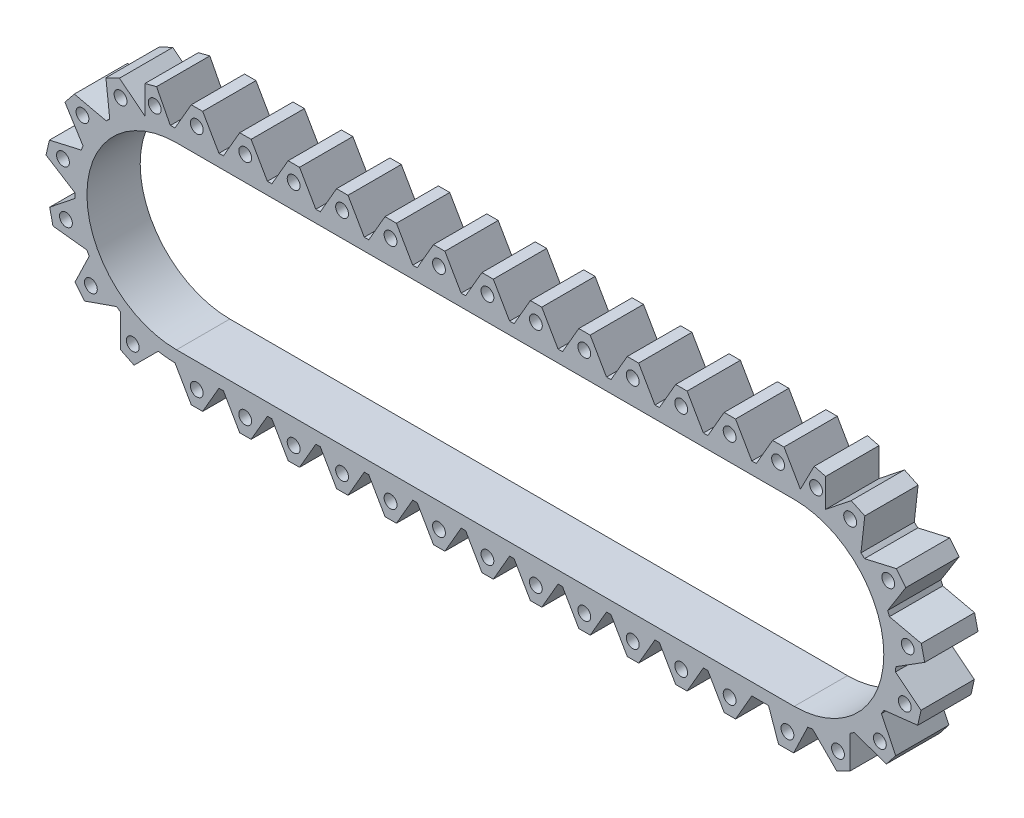
from build123d import *

# Parameters (mm, degrees)
SKETCH1_R           = 5.304855617
BOSS_EXTRUDE1_DEPTH = 44


with BuildPart() as part:
    # Sketch1 → Boss-Extrude1 (new body)
    with BuildSketch(Plane.XY):
        with BuildLine():
            Line((-368.279008081, 208.137347398), (-377.693162141, 208.137347398))
            Line((-377.693162141, 208.137347398), (-391.140624551, 184.84565927))
            ThreePointArc((-391.140624551, 184.84565927), (-393.055558066, 184.794572872), (-394.968828688, 184.699832656))
            Line((-394.968828688, 184.699832656), (-406.364309987, 206.757674175))
            Line((-406.364309987, 206.757674175), (-415.856306602, 204.306802161))
            Line((-415.856306602, 204.306802161), (-415.856306602, 180.730933767))
            Line((-415.856306602, 180.730933767), (-436.937315979, 197.542477756))
            Line((-436.937315979, 197.542477756), (-448.168387597, 192.210115525))
            Line((-448.168387597, 192.210115525), (-445.013595724, 164.210563225))
            ThreePointArc((-445.013595724, 164.210563225), (-446.491708161, 162.892805497), (-447.938347028, 161.540571127))
            Line((-447.938347028, 161.540571127), (-474.225935747, 167.540541709))
            Line((-474.225935747, 167.540541709), (-482.031156365, 157.863269999))
            Line((-482.031156365, 157.863269999), (-467.040236656, 134.005357956))
            ThreePointArc((-467.040236656, 134.005357956), (-467.800216295, 132.176770316), (-468.516880373, 130.330776165))
            Line((-468.516880373, 130.330776165), (-494.804469092, 124.330805583))
            Line((-494.804469092, 124.330805583), (-497.637919041, 112.225326739))
            Line((-497.637919041, 112.225326739), (-473.780006998, 97.234407031))
            ThreePointArc((-473.780006998, 97.234407031), (-473.671330551, 95.257163688), (-473.516075729, 93.283031538))
            Line((-473.516075729, 93.283031538), (-494.597085106, 76.471487549))
            Line((-494.597085106, 76.471487549), (-491.897564874, 64.335440122))
            Line((-491.897564874, 64.335440122), (-463.898012575, 61.180648248))
            ThreePointArc((-463.898012575, 61.180648248), (-462.942204744, 59.446366495), (-461.945781144, 57.73509743))
            Line((-461.945781144, 57.73509743), (-473.644858731, 33.441712501))
            Line((-473.644858731, 33.441712501), (-465.947041408, 23.678789521))
            Line((-465.947041408, 23.678789521), (-439.351503576, 32.984970704))
            ThreePointArc((-439.351503576, 32.984970704), (-437.737873826, 31.837146312), (-436.097635362, 30.727678157))
            Line((-436.097635362, 30.727678157), (-436.097635362, 3.764055113))
            Line((-436.097635362, 3.764055113), (-424.926168076, -1.692076789))
            Line((-424.926168076, -1.692076789), (-405.002217154, 18.231874134))
            ThreePointArc((-405.002217154, 18.231874134), (-398.099796392, 17.260748368), (-391.140624551, 16.865242473))
            Line((-391.140624551, 16.865242473), (-377.693162141, -6.426445656))
            Line((-377.693162141, -6.426445656), (-368.279008081, -6.426445656))
            Line((-368.279008081, -6.426445656), (-354.837198854, 16.855450871))
            Line((-354.837198854, 16.855450871), (-351.134971368, 16.855450871))
            Line((-351.134971368, 16.855450871), (-337.693162141, -6.426445656))
            Line((-337.693162141, -6.426445656), (-328.279008081, -6.426445656))
            Line((-328.279008081, -6.426445656), (-314.837198854, 16.855450871))
            Line((-314.837198854, 16.855450871), (-311.134971368, 16.855450871))
            Line((-311.134971368, 16.855450871), (-297.693162141, -6.426445656))
            Line((-297.693162141, -6.426445656), (-288.279008081, -6.426445656))
            Line((-288.279008081, -6.426445656), (-274.837198854, 16.855450871))
            Line((-274.837198854, 16.855450871), (-271.134971368, 16.855450871))
            Line((-271.134971368, 16.855450871), (-257.693162141, -6.426445656))
            Line((-257.693162141, -6.426445656), (-248.279008081, -6.426445656))
            Line((-248.279008081, -6.426445656), (-234.837198854, 16.855450871))
            Line((-234.837198854, 16.855450871), (-231.134971368, 16.855450871))
            Line((-231.134971368, 16.855450871), (-217.693162141, -6.426445656))
            Line((-217.693162141, -6.426445656), (-208.279008081, -6.426445656))
            Line((-208.279008081, -6.426445656), (-194.837198854, 16.855450871))
            Line((-194.837198854, 16.855450871), (-191.134971368, 16.855450871))
            Line((-191.134971368, 16.855450871), (-177.693162141, -6.426445656))
            Line((-177.693162141, -6.426445656), (-168.279008081, -6.426445656))
            Line((-168.279008081, -6.426445656), (-154.837198854, 16.855450871))
            Line((-154.837198854, 16.855450871), (-151.134971368, 16.855450871))
            Line((-151.134971368, 16.855450871), (-137.693162141, -6.426445656))
            Line((-137.693162141, -6.426445656), (-128.279008081, -6.426445656))
            Line((-128.279008081, -6.426445656), (-114.837198854, 16.855450871))
            Line((-114.837198854, 16.855450871), (-111.134971368, 16.855450871))
            Line((-111.134971368, 16.855450871), (-97.693162141, -6.426445656))
            Line((-97.693162141, -6.426445656), (-88.279008081, -6.426445656))
            Line((-88.279008081, -6.426445656), (-74.837198854, 16.855450871))
            Line((-74.837198854, 16.855450871), (-71.134971368, 16.855450871))
            Line((-71.134971368, 16.855450871), (-57.693162141, -6.426445656))
            Line((-57.693162141, -6.426445656), (-48.279008081, -6.426445656))
            Line((-48.279008081, -6.426445656), (-34.837198854, 16.855450871))
            Line((-34.837198854, 16.855450871), (-31.134971368, 16.855450871))
            Line((-31.134971368, 16.855450871), (-17.693162141, -6.426445656))
            Line((-17.693162141, -6.426445656), (-8.279008081, -6.426445656))
            Line((-8.279008081, -6.426445656), (5.162801146, 16.855450871))
            Line((5.162801146, 16.855450871), (8.865028632, 16.855450871))
            Line((8.865028632, 16.855450871), (22.306837859, -6.426445656))
            Line((22.306837859, -6.426445656), (31.720991919, -6.426445656))
            Line((31.720991919, -6.426445656), (45.162801146, 16.855450871))
            Line((45.162801146, 16.855450871), (48.865028632, 16.855450871))
            Line((48.865028632, 16.855450871), (62.306837859, -6.426445656))
            Line((62.306837859, -6.426445656), (71.720991919, -6.426445656))
            Line((71.720991919, -6.426445656), (85.162801146, 16.855450871))
            Line((85.162801146, 16.855450871), (88.865028632, 16.855450871))
            Line((88.865028632, 16.855450871), (88.971712538, 16.855450871))
            Line((88.971712538, 16.855450871), (98.982794632, 16.855450871))
            Line((98.982794632, 16.855450871), (107.129482574, -6.426445656))
            Line((107.129482574, -6.426445656), (107.243450607, -6.752147583))
            Line((107.243450607, -6.752147583), (119.675921751, -6.683460598))
            Line((119.675921751, -6.683460598), (131.374999338, 17.60992433))
            ThreePointArc((131.374999338, 17.60992433), (133.334183321, 17.897847801), (135.28603583, 18.231874134))
            Line((135.28603583, 18.231874134), (155.209986752, -1.692076789))
            Line((155.209986752, -1.692076789), (166.381454038, 3.764055113))
            Line((166.381454038, 3.764055113), (166.381454038, 30.727678157))
            ThreePointArc((166.381454038, 30.727678157), (168.021692502, 31.837146312), (169.635322252, 32.984970704))
            Line((169.635322252, 32.984970704), (196.230860084, 23.678789521))
            Line((196.230860084, 23.678789521), (203.928677407, 33.441712501))
            Line((203.928677407, 33.441712501), (192.22959982, 57.73509743))
            ThreePointArc((192.22959982, 57.73509743), (193.22602342, 59.446366495), (194.181831251, 61.180648248))
            Line((194.181831251, 61.180648248), (222.18138355, 64.335440122))
            Line((222.18138355, 64.335440122), (224.880903782, 76.471487549))
            Line((224.880903782, 76.471487549), (203.799894405, 93.283031538))
            ThreePointArc((203.799894405, 93.283031538), (203.955149227, 95.257163688), (204.063825674, 97.234407031))
            Line((204.063825674, 97.234407031), (227.921737717, 112.225326739))
            Line((227.921737717, 112.225326739), (225.088287768, 124.330805583))
            Line((225.088287768, 124.330805583), (198.800699049, 130.330776165))
            ThreePointArc((198.800699049, 130.330776165), (198.084034971, 132.176770316), (197.324055332, 134.005357956))
            Line((197.324055332, 134.005357956), (212.314975041, 157.863269999))
            Line((212.314975041, 157.863269999), (204.509754423, 167.540541709))
            Line((204.509754423, 167.540541709), (178.222165704, 161.540571127))
            ThreePointArc((178.222165704, 161.540571127), (176.775526837, 162.892805497), (175.2974144, 164.210563225))
            Line((175.2974144, 164.210563225), (178.452206273, 192.210115525))
            Line((178.452206273, 192.210115525), (167.221134655, 197.542477756))
            Line((167.221134655, 197.542477756), (146.140125278, 180.730933767))
            Line((146.140125278, 180.730933767), (146.140125278, 204.306802161))
            Line((146.140125278, 204.306802161), (136.648128663, 206.757674175))
            Line((136.648128663, 206.757674175), (125.252647364, 184.699832656))
            Line((125.252647364, 184.699832656), (111.720991919, 208.137347398))
            Line((111.720991919, 208.137347398), (102.306837859, 208.137347398))
            Line((102.306837859, 208.137347398), (88.865028632, 184.855450871))
            Line((88.865028632, 184.855450871), (85.162801146, 184.855450871))
            Line((85.162801146, 184.855450871), (76.790181677, 199.357253183))
            Line((76.790181677, 199.357253183), (71.720991919, 208.137347398))
            Line((71.720991919, 208.137347398), (62.306837859, 208.137347398))
            Line((62.306837859, 208.137347398), (48.865028632, 184.855450871))
            Line((48.865028632, 184.855450871), (45.162801146, 184.855450871))
            Line((45.162801146, 184.855450871), (31.720991919, 208.137347398))
            Line((31.720991919, 208.137347398), (22.306837859, 208.137347398))
            Line((22.306837859, 208.137347398), (8.865028632, 184.855450871))
            Line((8.865028632, 184.855450871), (5.162801146, 184.855450871))
            Line((5.162801146, 184.855450871), (-8.279008081, 208.137347398))
            Line((-8.279008081, 208.137347398), (-17.693162141, 208.137347398))
            Line((-17.693162141, 208.137347398), (-31.134971368, 184.855450871))
            Line((-31.134971368, 184.855450871), (-34.837198854, 184.855450871))
            Line((-34.837198854, 184.855450871), (-48.279008081, 208.137347398))
            Line((-48.279008081, 208.137347398), (-57.693162141, 208.137347398))
            Line((-57.693162141, 208.137347398), (-71.134971368, 184.855450871))
            Line((-71.134971368, 184.855450871), (-74.837198854, 184.855450871))
            Line((-74.837198854, 184.855450871), (-88.279008081, 208.137347398))
            Line((-88.279008081, 208.137347398), (-97.693162141, 208.137347398))
            Line((-97.693162141, 208.137347398), (-111.134971368, 184.855450871))
            Line((-111.134971368, 184.855450871), (-114.837198854, 184.855450871))
            Line((-114.837198854, 184.855450871), (-128.279008081, 208.137347398))
            Line((-128.279008081, 208.137347398), (-137.693162141, 208.137347398))
            Line((-137.693162141, 208.137347398), (-151.134971368, 184.855450871))
            Line((-151.134971368, 184.855450871), (-154.837198854, 184.855450871))
            Line((-154.837198854, 184.855450871), (-168.279008081, 208.137347398))
            Line((-168.279008081, 208.137347398), (-177.693162141, 208.137347398))
            Line((-177.693162141, 208.137347398), (-191.134971368, 184.855450871))
            Line((-191.134971368, 184.855450871), (-194.837198854, 184.855450871))
            Line((-194.837198854, 184.855450871), (-208.279008081, 208.137347398))
            Line((-208.279008081, 208.137347398), (-217.693162141, 208.137347398))
            Line((-217.693162141, 208.137347398), (-231.134971368, 184.855450871))
            Line((-231.134971368, 184.855450871), (-234.837198854, 184.855450871))
            Line((-234.837198854, 184.855450871), (-248.279008081, 208.137347398))
            Line((-248.279008081, 208.137347398), (-257.693162141, 208.137347398))
            Line((-257.693162141, 208.137347398), (-271.134971368, 184.855450871))
            Line((-271.134971368, 184.855450871), (-274.837198854, 184.855450871))
            Line((-274.837198854, 184.855450871), (-288.279008081, 208.137347398))
            Line((-288.279008081, 208.137347398), (-297.693162141, 208.137347398))
            Line((-297.693162141, 208.137347398), (-311.134971368, 184.855450871))
            Line((-311.134971368, 184.855450871), (-314.837198854, 184.855450871))
            Line((-314.837198854, 184.855450871), (-328.279008081, 208.137347398))
            Line((-328.279008081, 208.137347398), (-337.693162141, 208.137347398))
            Line((-337.693162141, 208.137347398), (-351.134971368, 184.855450871))
            Line((-351.134971368, 184.855450871), (-354.837198854, 184.855450871))
            Line((-354.837198854, 184.855450871), (-368.279008081, 208.137347398))
        make_face()
        with Locations((-426.021067812, 12.909443776)):
            Circle(SKETCH1_R, mode=Mode.SUBTRACT)
        with Locations((-373.153370384, 6.777668426)):
            Circle(SKETCH1_R, mode=Mode.SUBTRACT)
        with Locations((-333.153370384, 6.777668426)):
            Circle(SKETCH1_R, mode=Mode.SUBTRACT)
        with Locations((-460.598149643, 37.309364166)):
            Circle(SKETCH1_R, mode=Mode.SUBTRACT)
        with Locations((-293.153370384, 6.777668426)):
            Circle(SKETCH1_R, mode=Mode.SUBTRACT)
        with Locations((-253.153370384, 6.777668426)):
            Circle(SKETCH1_R, mode=Mode.SUBTRACT)
        with Locations((-213.153370384, 6.777668426)):
            Circle(SKETCH1_R, mode=Mode.SUBTRACT)
        with Locations((-173.153370384, 6.777668426)):
            Circle(SKETCH1_R, mode=Mode.SUBTRACT)
        with Locations((-481.164295224, 74.295366369)):
            Circle(SKETCH1_R, mode=Mode.SUBTRACT)
        with Locations((-133.153370384, 6.777668426)):
            Circle(SKETCH1_R, mode=Mode.SUBTRACT)
        with Locations((-93.153370384, 6.777668426)):
            Circle(SKETCH1_R, mode=Mode.SUBTRACT)
        with Locations((-53.153370384, 6.777668426)):
            Circle(SKETCH1_R, mode=Mode.SUBTRACT)
        with Locations((-13.153370384, 6.777668426)):
            Circle(SKETCH1_R, mode=Mode.SUBTRACT)
        with Locations((26.846629616, 6.777668426)):
            Circle(SKETCH1_R, mode=Mode.SUBTRACT)
        with Locations((66.846629616, 6.777668426)):
            Circle(SKETCH1_R, mode=Mode.SUBTRACT)
        with Locations((156.304886488, 12.909443776)):
            Circle(SKETCH1_R, mode=Mode.SUBTRACT)
        with Locations((190.881968319, 37.309364166)):
            Circle(SKETCH1_R, mode=Mode.SUBTRACT)
        with Locations((211.4481139, 74.295366369)):
            Circle(SKETCH1_R, mode=Mode.SUBTRACT)
        with Locations((-483.646127194, 116.541919046)):
            Circle(SKETCH1_R, mode=Mode.SUBTRACT)
        with Locations((-467.552088294, 155.681574319)):
            Circle(SKETCH1_R, mode=Mode.SUBTRACT)
        with Locations((-436.069800308, 183.962243445)):
            Circle(SKETCH1_R, mode=Mode.SUBTRACT)
        with Locations((-407.896104995, 192.210115525)):
            Circle(SKETCH1_R, mode=Mode.SUBTRACT)
        with Locations((-373.153370384, 194.933233316)):
            Circle(SKETCH1_R, mode=Mode.SUBTRACT)
        with Locations((-333.153370384, 194.933233316)):
            Circle(SKETCH1_R, mode=Mode.SUBTRACT)
        with Locations((-293.153370384, 194.933233316)):
            Circle(SKETCH1_R, mode=Mode.SUBTRACT)
        with Locations((-253.153370384, 194.933233316)):
            Circle(SKETCH1_R, mode=Mode.SUBTRACT)
        with Locations((-213.153370384, 194.933233316)):
            Circle(SKETCH1_R, mode=Mode.SUBTRACT)
        with Locations((-173.153370384, 194.933233316)):
            Circle(SKETCH1_R, mode=Mode.SUBTRACT)
        with BuildLine():
            Line((-389.858090662, 174.855450871), (-134.858090662, 174.855450871))
            Line((-134.858090662, 174.855450871), (120.141909338, 174.855450871))
            ThreePointArc((120.141909338, 174.855450871), (194.141909338, 100.855450871), (120.141909338, 26.855450871))
            Line((120.141909338, 26.855450871), (-389.858090662, 26.855450871))
            ThreePointArc((-389.858090662, 26.855450871), (-463.858090662, 100.855450871), (-389.858090662, 174.855450871))
        make_face(mode=Mode.SUBTRACT)
        with Locations((213.92994587, 116.541919046)):
            Circle(SKETCH1_R, mode=Mode.SUBTRACT)
        with Locations((-133.153370384, 194.933233316)):
            Circle(SKETCH1_R, mode=Mode.SUBTRACT)
        with Locations((-93.153370384, 194.933233316)):
            Circle(SKETCH1_R, mode=Mode.SUBTRACT)
        with Locations((-53.153370384, 194.933233316)):
            Circle(SKETCH1_R, mode=Mode.SUBTRACT)
        with Locations((-13.153370384, 194.933233316)):
            Circle(SKETCH1_R, mode=Mode.SUBTRACT)
        with Locations((26.846629616, 194.933233316)):
            Circle(SKETCH1_R, mode=Mode.SUBTRACT)
        with Locations((197.83590697, 155.681574319)):
            Circle(SKETCH1_R, mode=Mode.SUBTRACT)
        with Locations((66.846629616, 194.933233316)):
            Circle(SKETCH1_R, mode=Mode.SUBTRACT)
        with Locations((106.846629616, 194.933233316)):
            Circle(SKETCH1_R, mode=Mode.SUBTRACT)
        with Locations((166.353618984, 183.962243445)):
            Circle(SKETCH1_R, mode=Mode.SUBTRACT)
        with Locations((138.179923671, 192.210115525)):
            Circle(SKETCH1_R, mode=Mode.SUBTRACT)
        with Locations((114.565283522, 5.928308679)):
            Circle(SKETCH1_R, mode=Mode.SUBTRACT)
    extrude(amount=BOSS_EXTRUDE1_DEPTH)


solid = part.part
